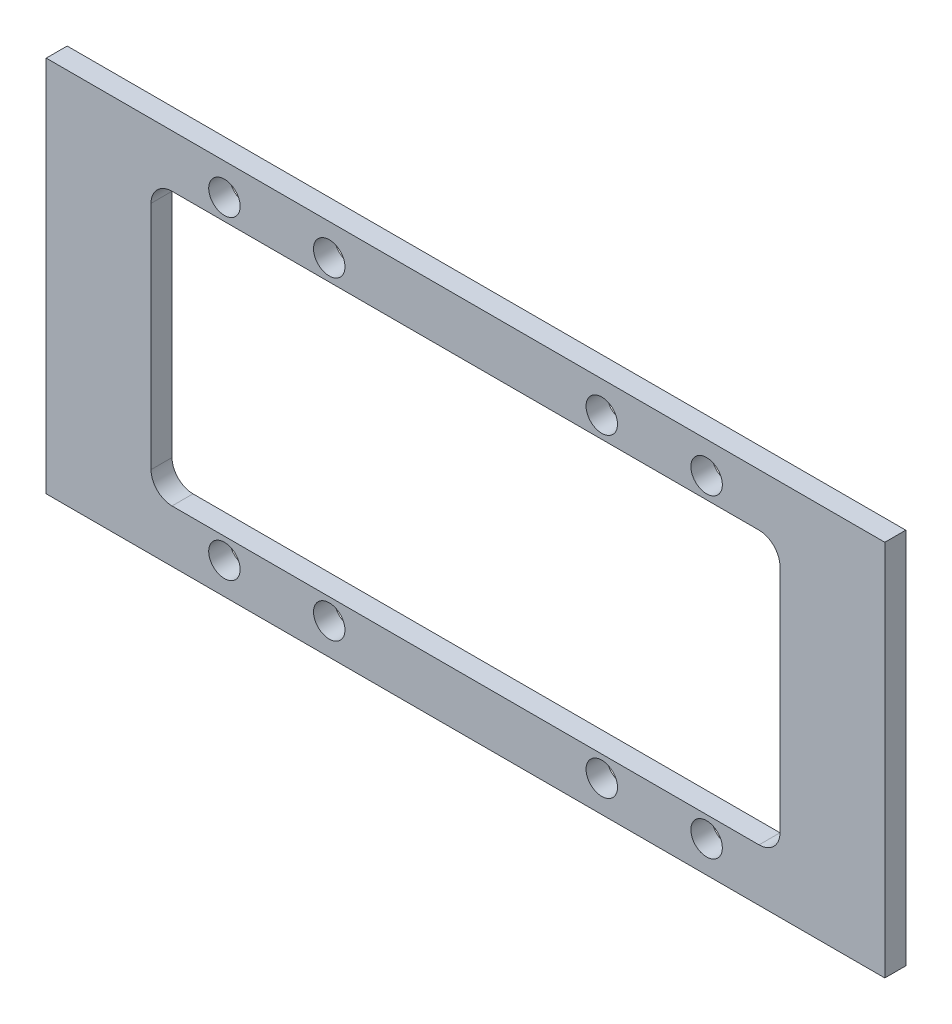
from build123d import *

# Parameters (mm, degrees)
SKETCH_1_W          = 80
SKETCH_1_H          = 36
EXTRUDE_1_DEPTH     = 2
CUT_EXTRUDE_1_DEPTH = 2
FILLET_2_R          = 2
SKETCH_3_R          = 1.5
CUT_EXTRUDE_2_DEPTH = 44.9089968


with BuildPart() as part:
    # 草图1 → 凸台-拉伸1 (new body)
    with BuildSketch(Plane.XY):
        Rectangle(SKETCH_1_W, SKETCH_1_H)
    extrude(amount=EXTRUDE_1_DEPTH)

    # 草图2 → 切除-拉伸1 (cut)
    with BuildSketch(Plane.XY.offset(2)):
        Polygon((-30, -8), (-30, -13), (30, -13), (30, -8), (30, 8), (30, 13), (-30, 13), (-30, 8), align=None)
    extrude(amount=-CUT_EXTRUDE_1_DEPTH, mode=Mode.SUBTRACT)

    # 圆角2
    fillet_2_edges = [part.edges().sort_by_distance(p)[0] for p in [
        (30, -13, 1),
        (-30, -13, 1),
        (-30, 13, 1),
        (30, 13, 1),
    ]]
    fillet(fillet_2_edges, radius=FILLET_2_R)

    # 草图3 → 切除-拉伸2 (cut, through all)
    with BuildSketch(Plane.XY.offset(2)):
        with Locations((23, -15)):
            Circle(SKETCH_3_R)
        with Locations((13, -15)):
            Circle(SKETCH_3_R)
        with Locations((-13, -15)):
            Circle(SKETCH_3_R)
        with Locations((-23, -15)):
            Circle(SKETCH_3_R)
        with Locations((23, 15)):
            Circle(SKETCH_3_R)
        with Locations((13, 15)):
            Circle(SKETCH_3_R)
        with Locations((-13, 15)):
            Circle(SKETCH_3_R)
        with Locations((-23, 15)):
            Circle(SKETCH_3_R)
    extrude(amount=-CUT_EXTRUDE_2_DEPTH, mode=Mode.SUBTRACT)


solid = part.part
